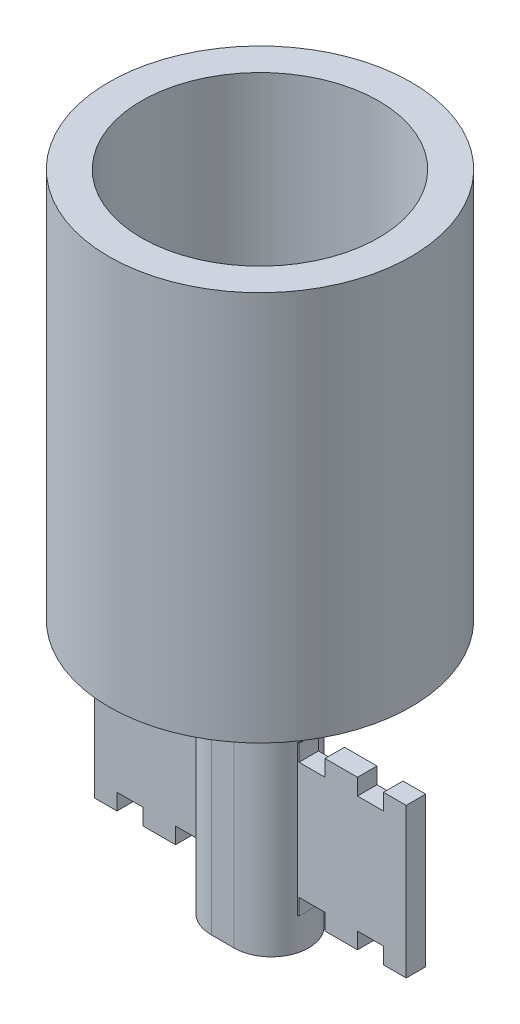
from build123d import *

# Parameters (mm, degrees)
SKETCH1_R           = 4.65
BOSS_EXTRUDE1_DEPTH = 1
SKETCH2_R           = 4.65
SKETCH2_R_2         = 3.65
BOSS_EXTRUDE2_DEPTH = 11
BOSS_EXTRUDE3_DEPTH = 8
SKETCH4_W           = 9.6
SKETCH4_H           = 4.6
BOSS_EXTRUDE4_DEPTH = 0.3
SKETCH5_W           = 0.8
SKETCH5_H           = 0.5
CUT_EXTRUDE1_DEPTH  = 14.839888005
CUT_EXTRUDE2_DEPTH  = 14.735446844


with BuildPart() as part:
    # Sketch1 → Boss-Extrude1 (new body)
    with BuildSketch(Plane(origin=(0, 0, 0), x_dir=(1, 0, 0), z_dir=(0, 1, 0))):
        with Locations(Location((0, 0, 0), (0, 0, 270))):
            Circle(SKETCH1_R)
    extrude(amount=BOSS_EXTRUDE1_DEPTH)

    # Sketch2 → Boss-Extrude2 (add)
    with BuildSketch(Plane(origin=(0, 1, 0), x_dir=(1, 0, 0), z_dir=(0, 1, 0))):
        with Locations(Location((0, 0, 0), (0, 0, 270))):
            Circle(SKETCH2_R)
        with Locations(Location((0, 0, 0), (0, 0, 270))):
            Circle(SKETCH2_R_2, mode=Mode.SUBTRACT)
    extrude(amount=BOSS_EXTRUDE2_DEPTH)

    # Sketch3 → Boss-Extrude3 (add)
    with BuildSketch(Plane.XZ):
        with BuildLine():
            Line((0.35, -1.15), (-0.35, -1.15))
            ThreePointArc((-0.35, -1.15), (-1.5, 0), (-0.35, 1.15))
            Line((-0.35, 1.15), (0.35, 1.15))
            ThreePointArc((0.35, 1.15), (1.5, 0), (0.35, -1.15))
        make_face()
    extrude(amount=BOSS_EXTRUDE3_DEPTH)

    # Sketch4 → Boss-Extrude4 (add, symmetric)
    with BuildSketch(Plane.XY):
        with Locations((0, -4.7)):
            Rectangle(SKETCH4_W, SKETCH4_H)
    extrude(amount=BOSS_EXTRUDE4_DEPTH, both=True)

    # Sketch5 → Cut-Extrude1 (cut, through all)
    with BuildSketch(Plane(origin=(0, 0, -0.3), x_dir=(-1, 0, 0), z_dir=(0, 0, -1))):
        with Locations((-1.9, -2.65)):
            Rectangle(SKETCH5_W, SKETCH5_H)
        with Locations((-3.7, -2.65)):
            Rectangle(SKETCH5_W, SKETCH5_H)
        with Locations((3.7, -2.65)):
            Rectangle(SKETCH5_W, SKETCH5_H)
        with Locations((1.9, -2.65)):
            Rectangle(SKETCH5_W, SKETCH5_H)
        with Locations((1.9, -6.75)):
            Rectangle(SKETCH5_W, SKETCH5_H)
        with Locations((3.7, -6.75)):
            Rectangle(SKETCH5_W, SKETCH5_H)
        with Locations((-3.7, -6.75)):
            Rectangle(SKETCH5_W, SKETCH5_H)
        with Locations((-1.9, -6.75)):
            Rectangle(SKETCH5_W, SKETCH5_H)
    extrude(amount=-CUT_EXTRUDE1_DEPTH, mode=Mode.SUBTRACT)

    # Sketch6 → Cut-Extrude2 (cut, through all)
    with BuildSketch(Plane.XZ):
        with BuildLine():
            Line((-0.75, 1.5), (-2.25, 1.5))
            ThreePointArc((-2.25, 1.5), (-2.75, 2), (-2.25, 2.5))
            Line((-2.25, 2.5), (-0.75, 2.5))
            ThreePointArc((-0.75, 2.5), (-0.25, 2), (-0.75, 1.5))
        make_face()
        with BuildLine():
            Line((0.75, 1.5), (2.25, 1.5))
            ThreePointArc((2.25, 1.5), (2.75, 2), (2.25, 2.5))
            Line((2.25, 2.5), (0.75, 2.5))
            ThreePointArc((0.75, 2.5), (0.25, 2), (0.75, 1.5))
        make_face()
    extrude(amount=-CUT_EXTRUDE2_DEPTH, mode=Mode.SUBTRACT)


solid = part.part
